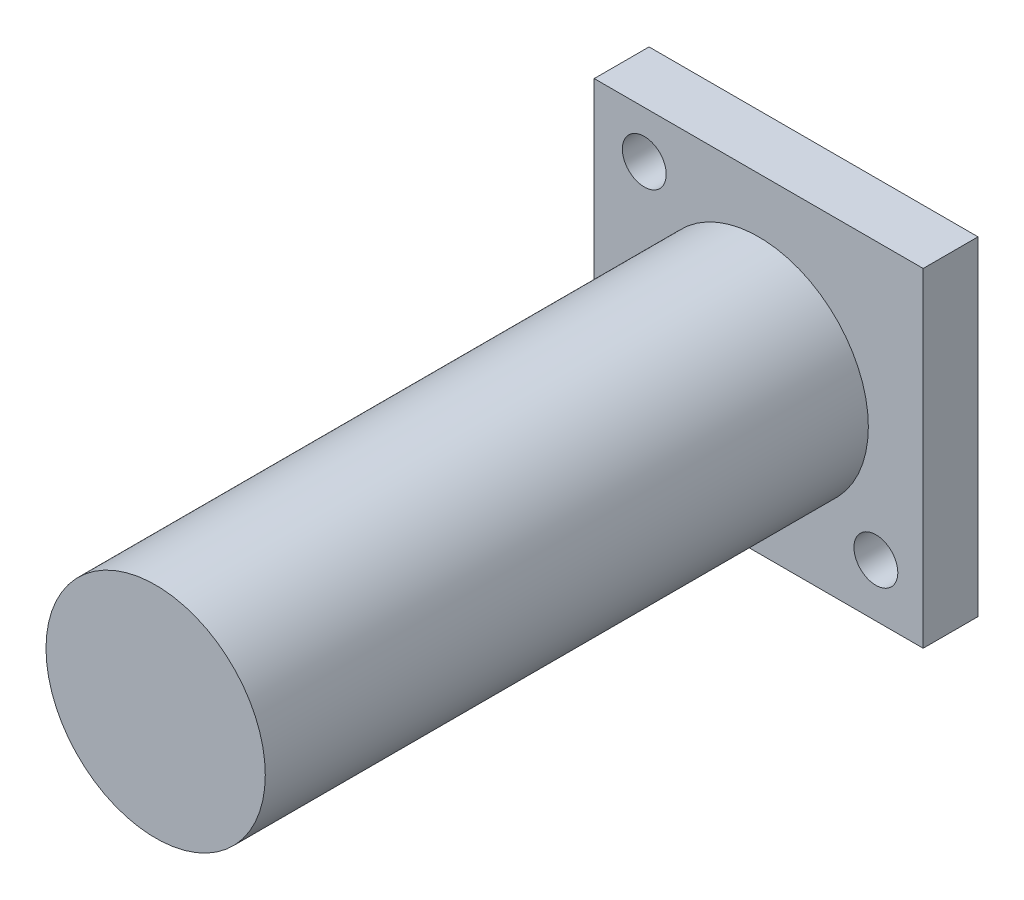
from build123d import *

# Parameters (mm, degrees)
SKETCH1_R                 = 10
BOSS_EXTRUDE1_DEPTH       = 60
SKETCH3_W                 = 30
SKETCH3_H                 = 30
BOSS_EXTRUDE2_DEPTH       = 5
F_4_0MM_DOWEL_HOLE1_D     = 4
F_4_0MM_DOWEL_HOLE1_DEPTH = 35
F_4_0MM_DOWEL_HOLE1_TIP   = 1.201721238


with BuildPart() as part:
    # Sketch1 → Boss-Extrude1 (new body)
    with BuildSketch(Plane.XY):
        with Locations(Location((0, 0, 0), (0, 0, 180))):
            Circle(SKETCH1_R)
    extrude(amount=BOSS_EXTRUDE1_DEPTH)

    # Sketch3 → Boss-Extrude2 (add)
    with BuildSketch(Plane(origin=(0, 0, 0), x_dir=(-1, 0, 0), z_dir=(0, 0, -1))):
        Rectangle(SKETCH3_W, SKETCH3_H)
    extrude(amount=-BOSS_EXTRUDE2_DEPTH)

    # Ø4.0mm Dowel Hole1
    with Locations(Plane(origin=(-10.433527311, 10.715968246, 5), x_dir=(1, 0, 0), z_dir=(0, 0, 1))):
        with Locations((0, 0), (21.120601919, -20.899829076)):
            Hole(F_4_0MM_DOWEL_HOLE1_D / 2, depth=F_4_0MM_DOWEL_HOLE1_DEPTH)
            with Locations((0, 0, -(F_4_0MM_DOWEL_HOLE1_DEPTH + F_4_0MM_DOWEL_HOLE1_TIP / 2))):  # 118° drill point
                Cone(0, F_4_0MM_DOWEL_HOLE1_D / 2, F_4_0MM_DOWEL_HOLE1_TIP, mode=Mode.SUBTRACT)


solid = part.part
